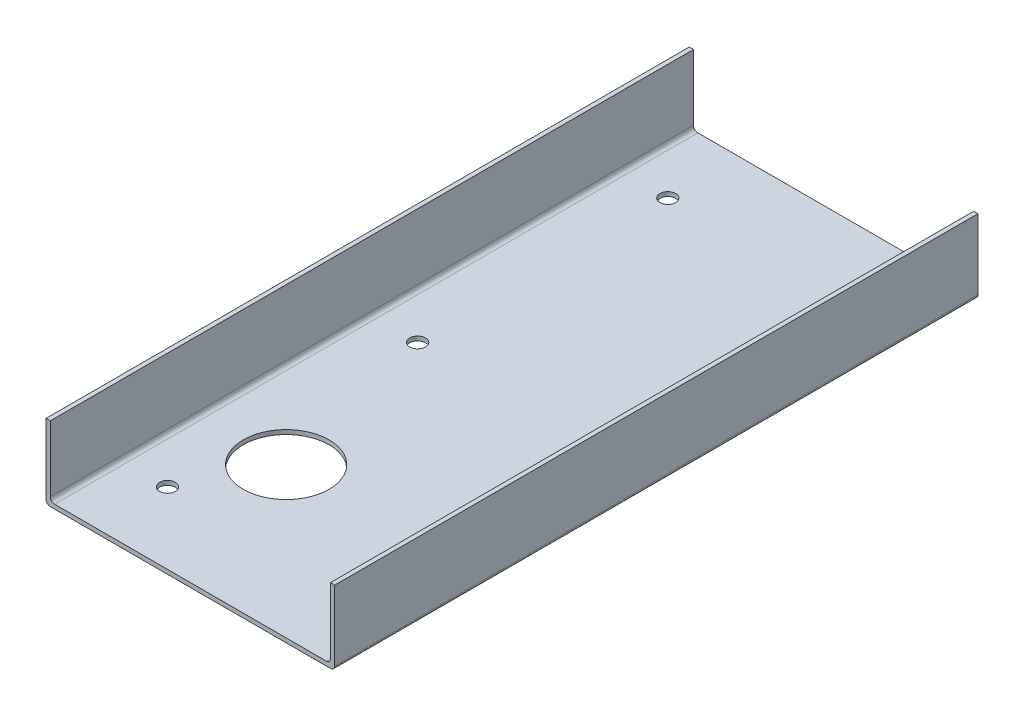
from build123d import *

# Parameters (mm, degrees)
BOSS_EXTRUDE1_DEPTH          = 450
SKETCH3_R                    = 30
CUT_EXTRUDE2_DEPTH           = 609.050936432
M10_CLEARANCE_SLOT1_D        = 11
CUT_EXTRUDE_THIN4_DEPTH      = 609.050936432
CUT_EXTRUDE_THIN4_DEPTH_BACK = 0.1
CUT_EXTRUDE_THIN5_DEPTH      = 609.050936432
CUT_EXTRUDE_THIN5_DEPTH_BACK = 0.1
CUT_EXTRUDE_THIN6_DEPTH      = 609.050936432
CUT_EXTRUDE_THIN6_DEPTH_BACK = 0.1


with BuildPart() as part:
    # Sketch1 → Boss-Extrude1 (new body)
    with BuildSketch(Plane.XY):
        with BuildLine():
            Line((-96.40006218, 31.988224321), (-96.40006218, -14.011775679))
            ThreePointArc((-96.40006218, -14.011775679), (-95.521382524, -16.133096022), (-93.40006218, -17.011775679))
            Line((-93.40006218, -17.011775679), (96.59993782, -17.011775679))
            ThreePointArc((96.59993782, -17.011775679), (98.721258163, -16.133096022), (99.59993782, -14.011775679))
            Line((99.59993782, -14.011775679), (99.59993782, 31.988224321))
            Line((99.59993782, 31.988224321), (102.59993782, 31.988224321))
            Line((102.59993782, 31.988224321), (102.59993782, -17.011775679))
            ThreePointArc((102.59993782, -17.011775679), (101.721258163, -19.133096022), (99.59993782, -20.011775679))
            Line((99.59993782, -20.011775679), (-96.40006218, -20.011775679))
            ThreePointArc((-96.40006218, -20.011775679), (-98.521382524, -19.133096022), (-99.40006218, -17.011775679))
            Line((-99.40006218, -17.011775679), (-99.40006218, 31.988224321))
            Line((-99.40006218, 31.988224321), (-96.40006218, 31.988224321))
        make_face()
    extrude(amount=BOSS_EXTRUDE1_DEPTH)

    # Sketch3 → Cut-Extrude2 (cut, through all)
    with BuildSketch(Plane(origin=(-323.698265728, -20.011775679, 19.544679499), x_dir=(0, 0, -1), z_dir=(0, -1, 0))):
        with Locations((-325.455320501, 287.298203547)):
            Circle(SKETCH3_R)
    extrude(amount=-CUT_EXTRUDE2_DEPTH, mode=Mode.SUBTRACT)

    # M10 Clearance Slot1 (through all)
    with Locations(Plane(origin=(-323.698265728, -20.011775679, 19.544679499), x_dir=(0, 0, -1), z_dir=(0, -1, 0))):
        with Locations((-380.455320501, 390.298203547), (-205.455320501, 390.298203547), (-30.455320501, 390.298203547), (-30.455320501, 259.298203547), (-205.455320501, 259.298203547), (-380.455320501, 259.298203547)):
            Hole(M10_CLEARANCE_SLOT1_D / 2)

    # Sketch9 → Cut-Extrude-Thin4 (cut, two sides: drawn at the far end of the back side and taken through both)
    with BuildSketch(Plane(origin=(-323.698265728, -20.011775679, 19.544679499), x_dir=(0, 0, -1), z_dir=(0, -1, 0)).offset(-CUT_EXTRUDE_THIN4_DEPTH_BACK)):
        Polygon((-307.687440193, 227.298203547), (-307.687440193, 262.63145603), (-256.25354627, 262.63145603), (-256.25354627, 227.298203547), (-256.15354627, 227.298203547), (-256.15354627, 262.73145603), (-307.787440193, 262.73145603), (-307.787440193, 227.298203547), align=None)
    extrude(amount=CUT_EXTRUDE_THIN4_DEPTH + CUT_EXTRUDE_THIN4_DEPTH_BACK, mode=Mode.SUBTRACT)

    # Sketch10 → Cut-Extrude-Thin5 (cut, two sides: drawn at the far end of the back side and taken through both)
    with BuildSketch(Plane(origin=(-323.698265728, -20.011775679, 19.544679499), x_dir=(0, 0, -1), z_dir=(0, -1, 0)).offset(-CUT_EXTRUDE_THIN5_DEPTH_BACK)):
        Polygon((-69.477840086, 227.298203547), (-69.477840086, 262.740474595), (-120.654750778, 262.740474595), (-120.654750778, 227.298203547), (-120.554750778, 227.298203547), (-120.554750778, 262.640474595), (-69.577840086, 262.640474595), (-69.577840086, 227.298203547), align=None)
    extrude(amount=CUT_EXTRUDE_THIN5_DEPTH + CUT_EXTRUDE_THIN5_DEPTH_BACK, mode=Mode.SUBTRACT)

    # Sketch11 → Cut-Extrude-Thin6 (cut, two sides: drawn at the far end of the back side and taken through both)
    with BuildSketch(Plane(origin=(-323.698265728, -20.011775679, 19.544679499), x_dir=(0, 0, -1), z_dir=(0, -1, 0)).offset(-CUT_EXTRUDE_THIN6_DEPTH_BACK)):
        Polygon((-162.791670666, 423.298203547), (-162.791670666, 403.614782025), (-214.233995463, 403.614782025), (-214.233995463, 423.298203547), (-214.333995463, 423.298203547), (-214.333995463, 403.514782025), (-162.691670666, 403.514782025), (-162.691670666, 423.298203547), align=None)
    extrude(amount=CUT_EXTRUDE_THIN6_DEPTH + CUT_EXTRUDE_THIN6_DEPTH_BACK, mode=Mode.SUBTRACT)


solid = part.part
